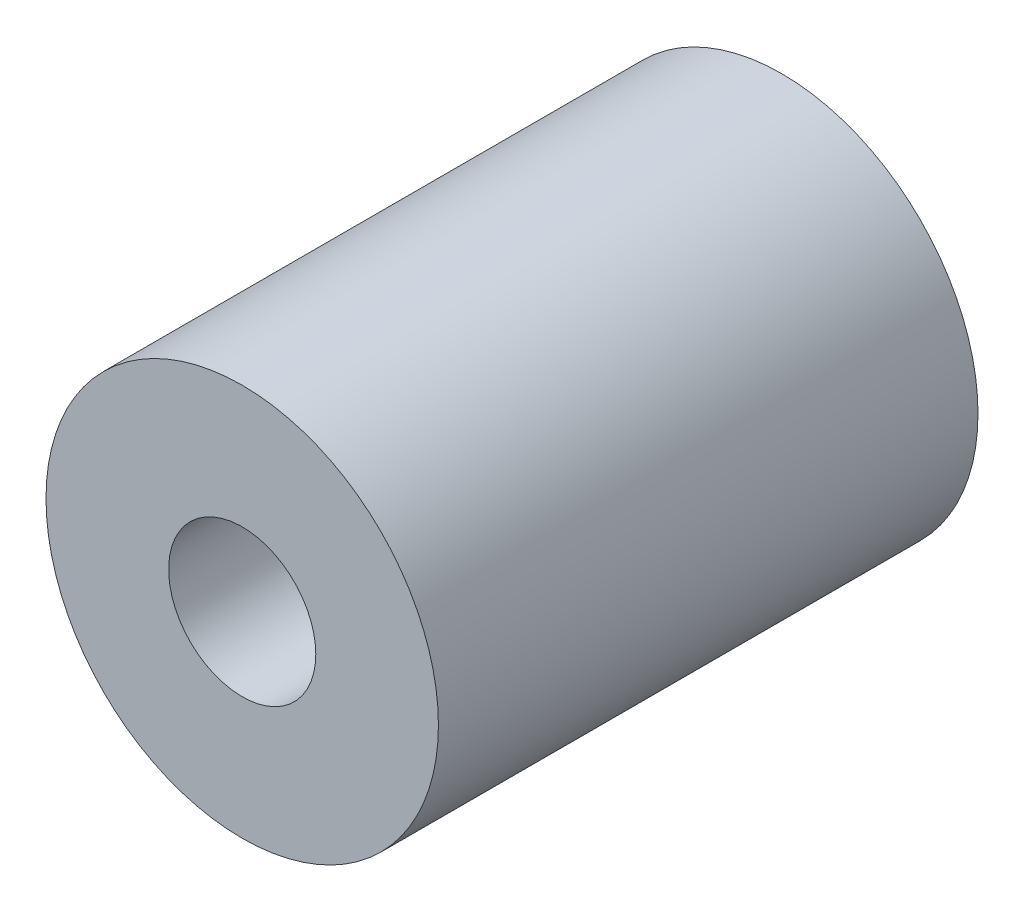
from build123d import *

# Parameters (mm, degrees)
SKETCH1_R           = 8
SKETCH1_R_2         = 3
BOSS_EXTRUDE1_DEPTH = 11


with BuildPart() as part:
    # Sketch1 → Boss-Extrude1 (new, symmetric)
    with BuildSketch(Plane.XY):
        Circle(SKETCH1_R)
        Circle(SKETCH1_R_2, mode=Mode.SUBTRACT)
    extrude(amount=BOSS_EXTRUDE1_DEPTH, both=True)


solid = part.part
